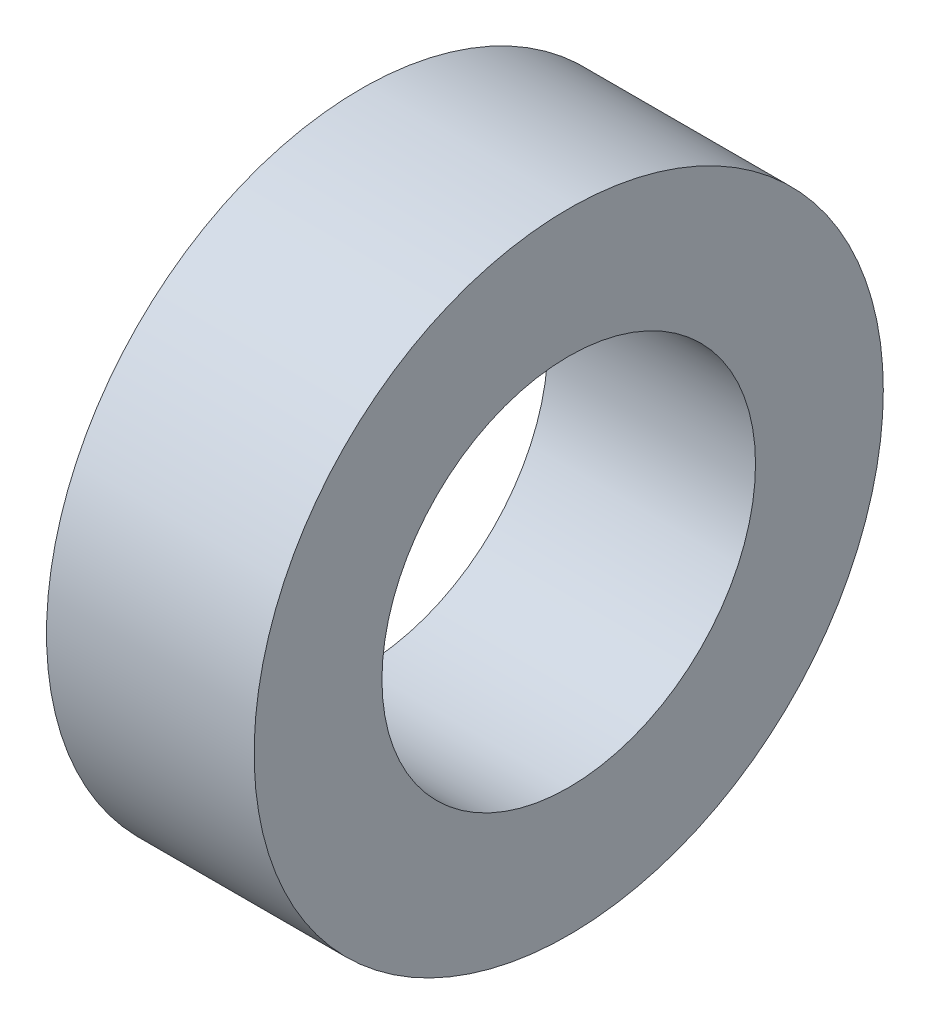
from build123d import *

# Parameters (mm, degrees)
SKETCH1_R           = 12.7
SKETCH1_R_2         = 7.540625
BOSS_EXTRUDE1_DEPTH = 8.382


with BuildPart() as part:
    # Sketch1 → Boss-Extrude1 (new body)
    with BuildSketch(Plane(origin=(0, 0, 0), x_dir=(0, 0, -1), z_dir=(1, 0, 0))):
        Circle(SKETCH1_R)
        Circle(SKETCH1_R_2, mode=Mode.SUBTRACT)
    extrude(amount=BOSS_EXTRUDE1_DEPTH)


solid = part.part
